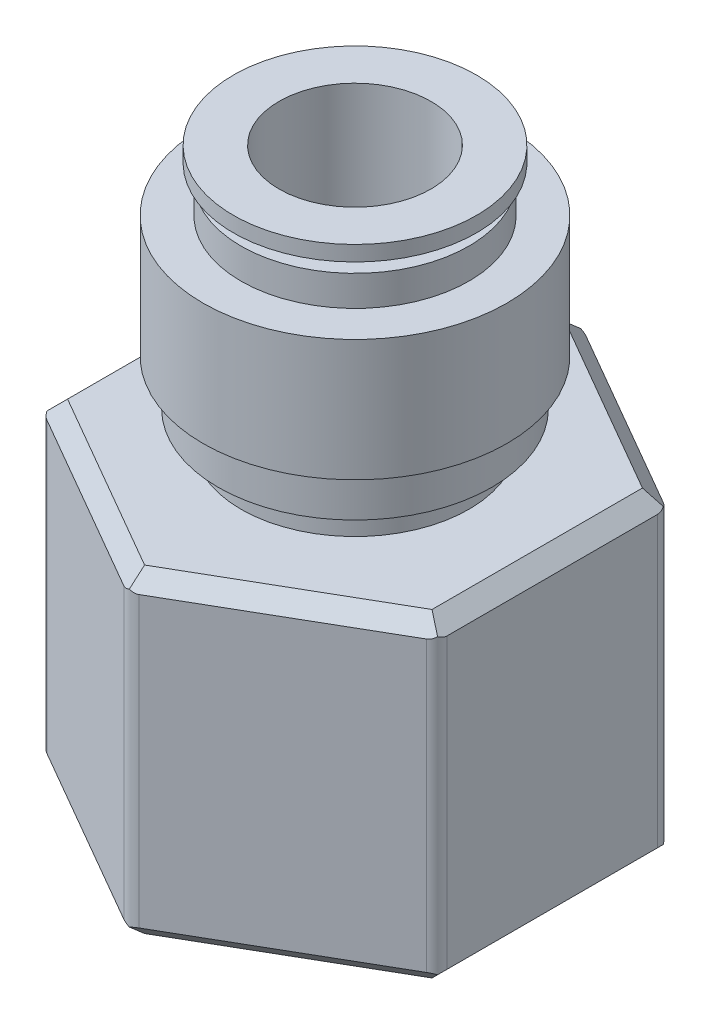
from build123d import *

# Parameters (mm, degrees)
EXTRUDE_1_DEPTH          = 21
SKETCH_2_R               = 7.5
EXTRUDE_2_DEPTH          = 2
SKETCH_3_R               = 9
EXTRUDE_3_DEPTH          = 3
SKETCH_4_R               = 10
EXTRUDE_4_DEPTH          = 8
SKETCH_5_R               = 7.5
EXTRUDE_5_DEPTH          = 2
CUT_EXTRUDE_1_DEPTH      = 42.106568818
CUT_EXTRUDE_1_DEPTH_BACK = 42.106568818
SKETCH_7_R               = 4
HOLE_WIZARD_G1_21_D      = 19
HOLE_WIZARD_G1_21_DEPTH  = 18
HOLE_WIZARD_G1_21_TIP    = 5.708175881
CHAMFER_1_SIZE           = 1
FILLET_1_R               = 1
SKETCH_10_R              = 5
CUT_EXTRUDE_2_DEPTH      = 40


with BuildPart() as part:
    # Эскиз1 → Бобышка-Вытянуть1 (new body)
    with BuildSketch(Plane(origin=(0, 0, 0), x_dir=(1, 0, 0), z_dir=(0, 1, 0))):
        Polygon((0, 15), (-12.990381057, 7.5), (-12.990381057, -7.5), (0, -15), (12.990381057, -7.5), (12.990381057, 7.5), align=None)
    extrude(amount=EXTRUDE_1_DEPTH)

    # Эскиз2 → Бобышка-Вытянуть2 (add)
    with BuildSketch(Plane(origin=(0, 21, 0), x_dir=(1, 0, 0), z_dir=(0, 1, 0))):
        with Locations(Location((0, 0, 0), (0, 0, 270))):
            Circle(SKETCH_2_R)
    extrude(amount=EXTRUDE_2_DEPTH)

    # Эскиз3 → Бобышка-Вытянуть3 (add)
    with BuildSketch(Plane(origin=(0, 23, 0), x_dir=(1, 0, 0), z_dir=(0, 1, 0))):
        with Locations(Location((0, 0, 0), (0, 0, 270))):
            Circle(SKETCH_3_R)
    extrude(amount=EXTRUDE_3_DEPTH)

    # Эскиз4 → Бобышка-Вытянуть4 (add)
    with BuildSketch(Plane(origin=(0, 26, 0), x_dir=(1, 0, 0), z_dir=(0, 1, 0))):
        with Locations(Location((0, 0, 0), (0, 0, 270))):
            Circle(SKETCH_4_R)
    extrude(amount=EXTRUDE_4_DEPTH)

    # Эскиз5 → Бобышка-Вытянуть5 (add)
    with BuildSketch(Plane(origin=(0, 34, 0), x_dir=(1, 0, 0), z_dir=(0, 1, 0))):
        with Locations(Location((0, 0, 0), (0, 0, 270))):
            Circle(SKETCH_5_R)
    extrude(amount=EXTRUDE_5_DEPTH)

    # Эскиз6 → Повернуть1 (revolve)
    with BuildSketch(Plane.XY, mode=Mode.PRIVATE) as revolve_1_sk:
        Polygon((-8, 37), (-6, 37), (-6, 36), (-4, 36), (-4, 38), (-8, 38), align=None)
    revolve(revolve_1_sk.sketch.rotate(Axis((0, 36, 0), (0, 1, 0)), 270), axis=Axis((0, 36, 0), (0, 1, 0)))

    # Эскиз7 → Вырез-Вытянуть1 (cut, two sides: drawn at the far end of the back side and taken through both)
    with BuildSketch(Plane(origin=(0, 36, 0), x_dir=(1, 0, 0), z_dir=(0, 1, 0)).offset(-CUT_EXTRUDE_1_DEPTH_BACK)):
        with Locations(Location((0, 0, 0), (0, 0, 90))):
            Circle(SKETCH_7_R)
    extrude(amount=CUT_EXTRUDE_1_DEPTH + CUT_EXTRUDE_1_DEPTH_BACK, mode=Mode.SUBTRACT)

    # Отверстие обработанное метчиком G1/21
    with Locations(Plane(origin=(0, 0, 0), x_dir=(-1, 0, 0), z_dir=(0, -1, 0))):
        with Locations((0, 0)):
            Hole(HOLE_WIZARD_G1_21_D / 2, depth=HOLE_WIZARD_G1_21_DEPTH)
            with Locations((0, 0, -(HOLE_WIZARD_G1_21_DEPTH + HOLE_WIZARD_G1_21_TIP / 2))):  # 118° drill point
                Cone(0, HOLE_WIZARD_G1_21_D / 2, HOLE_WIZARD_G1_21_TIP, mode=Mode.SUBTRACT)

    # Фаска1
    chamfer_1_edges = [part.edges().sort_by_distance(p)[0] for p in [
        (-12.990381057, 21, 0),
        (-6.495190528, 21, 11.25),
        (6.495190528, 21, 11.25),
        (12.990381057, 21, 0),
        (6.495190528, 21, -11.25),
        (-9.5, 0, 0),
        (12.990381057, 0, 0),
        (6.495190528, 0, 11.25),
        (-6.495190528, 0, 11.25),
        (-6.495190528, 21, -11.25),
        (-12.990381057, 0, 0),
        (-6.495190528, 0, -11.25),
        (6.495190528, 0, -11.25),
    ]]
    chamfer(chamfer_1_edges, length=CHAMFER_1_SIZE)

    # Скругление1
    fillet_1_edges = [part.edges().sort_by_distance(p)[0] for p in [
        (12.990381057, 10.5, -7.5),
        (12.990381057, 10.5, 7.5),
        (0, 10.5, 15),
        (-12.990381057, 10.5, 7.5),
        (-12.990381057, 10.5, -7.5),
        (0, 10.5, -15),
    ]]
    fillet(fillet_1_edges, radius=FILLET_1_R)

    # Эскиз10 → Вырез-Вытянуть2 (cut)
    with BuildSketch(Plane(origin=(0, 38, 0), x_dir=(1, 0, 0), z_dir=(0, 1, 0))):
        with Locations(Location((0, 0, 0), (0, 0, 270))):
            Circle(SKETCH_10_R)
    extrude(amount=-CUT_EXTRUDE_2_DEPTH, mode=Mode.SUBTRACT)


solid = part.part
